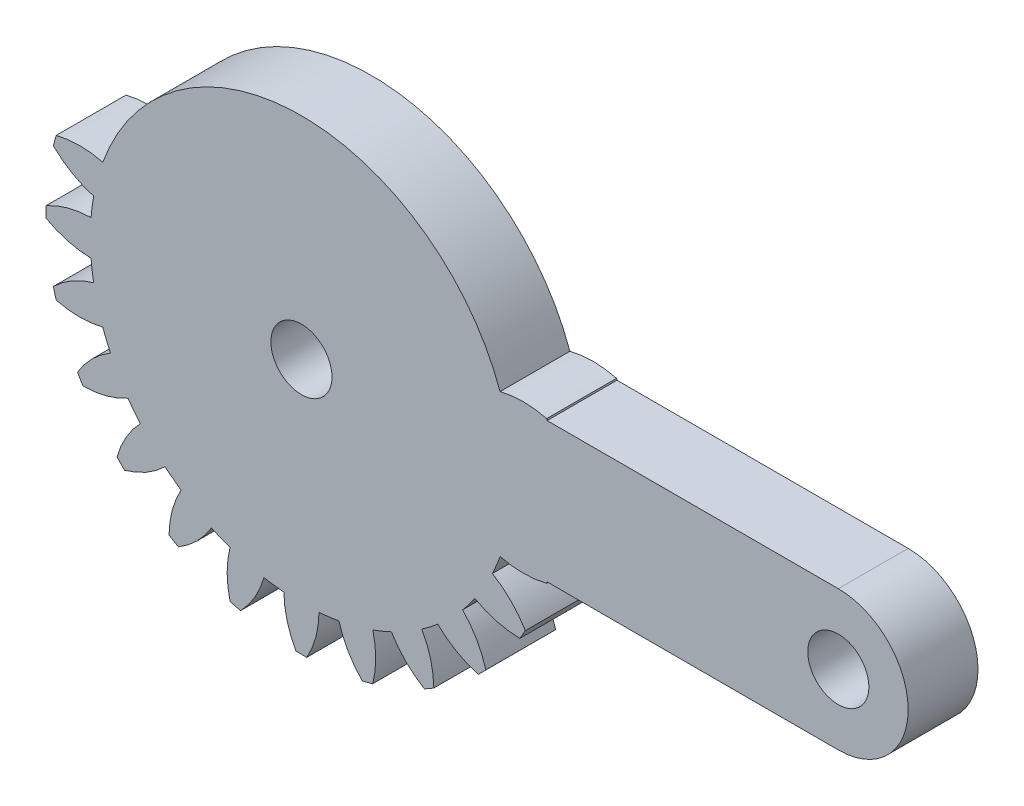
from build123d import *

# Parameters (mm, degrees)
SKETCH1_R           = 1.75
BOSS_EXTRUDE1_DEPTH = 4


with BuildPart() as part:
    # Sketch1 → Boss-Extrude1 (new body)
    with BuildSketch(Plane.XY):
        with BuildLine():
            ThreePointArc((14.048088143, -4.085109489), (14.06038767, -4.04257326), (14.072558403, -4))
            Line((14.072558403, -4), (30.75, -4))
            ThreePointArc((30.75, -4), (34.75, 0), (30.75, 4))
            Line((30.75, 4), (14.072558403, 4))
            ThreePointArc((14.072558403, 4), (14.06038767, 4.04257326), (14.048088143, 4.085109489))
            ThreePointArc((14.048088143, 4.085109489), (12.712915648, 4.255390909), (11.377106712, 4.090176385))
            ThreePointArc((11.377106712, 4.090176385), (0, 12.09), (-11.377106712, 4.090176385))
            ThreePointArc((-11.377106712, 4.090176385), (-12.712915648, 4.255390909), (-14.048088143, 4.085109489))
            ThreePointArc((-14.048088143, 4.085109489), (-14.131494839, 3.78652263), (-14.208555951, 3.486235477))
            ThreePointArc((-14.208555951, 3.486235477), (-13.137403362, 2.671181194), (-11.897951627, 2.1463567))
            ThreePointArc((-11.897951627, 2.1463567), (-11.986568374, 1.578061664), (-12.048056748, 1.00619511))
            ThreePointArc((-12.048056748, 1.00619511), (-13.381109763, 0.820047291), (-14.626715284, 0.31))
            ThreePointArc((-14.626715284, 0.31), (-14.63, 0), (-14.626715284, -0.31))
            ThreePointArc((-14.626715284, -0.31), (-13.381109763, -0.820047291), (-12.048056748, -1.00619511))
            ThreePointArc((-12.048056748, -1.00619511), (-11.986568374, -1.578061664), (-11.897951627, -2.1463567))
            ThreePointArc((-11.897951627, -2.1463567), (-13.137403362, -2.671181194), (-14.208555951, -3.486235477))
            ThreePointArc((-14.208555951, -3.486235477), (-14.131494839, -3.78652263), (-14.048088143, -4.085109489))
            ThreePointArc((-14.048088143, -4.085109489), (-12.712915648, -4.255390909), (-11.377106712, -4.090176385))
            ThreePointArc((-11.377106712, -4.090176385), (-11.169703548, -4.626642697), (-10.937020765, -5.152637848))
            ThreePointArc((-10.937020765, -5.152637848), (-11.998404632, -5.980373095), (-12.82210701, -7.044889767))
            ThreePointArc((-12.82210701, -7.044889767), (-12.669951657, -7.315), (-12.51210701, -7.581825517))
            ThreePointArc((-12.51210701, -7.581825517), (-11.17835734, -7.400736668), (-9.930825655, -6.8954189))
            ThreePointArc((-9.930825655, -6.8954189), (-9.591641884, -7.359925677), (-9.230750012, -7.807775241))
            ThreePointArc((-9.230750012, -7.807775241), (-10.041734454, -8.882012453), (-10.561852666, -10.123446462))
            ThreePointArc((-10.561852666, -10.123446462), (-10.344972209, -10.344972209), (-10.123446462, -10.561852666))
            ThreePointArc((-10.123446462, -10.561852666), (-8.882012453, -10.041734454), (-7.807775241, -9.230750012))
            ThreePointArc((-7.807775241, -9.230750012), (-7.359925677, -9.591641884), (-6.8954189, -9.930825655))
            ThreePointArc((-6.8954189, -9.930825655), (-7.400736668, -11.17835734), (-7.581825517, -12.51210701))
            ThreePointArc((-7.581825517, -12.51210701), (-7.315, -12.669951657), (-7.044889767, -12.82210701))
            ThreePointArc((-7.044889767, -12.82210701), (-5.980373095, -11.998404632), (-5.152637848, -10.937020765))
            ThreePointArc((-5.152637848, -10.937020765), (-4.626642697, -11.169703548), (-4.090176385, -11.377106712))
            ThreePointArc((-4.090176385, -11.377106712), (-4.255390909, -12.712915648), (-4.085109489, -14.048088143))
            ThreePointArc((-4.085109489, -14.048088143), (-3.78652263, -14.131494839), (-3.486235477, -14.208555951))
            ThreePointArc((-3.486235477, -14.208555951), (-2.671181194, -13.137403362), (-2.1463567, -11.897951627))
            ThreePointArc((-2.1463567, -11.897951627), (-1.578061664, -11.986568374), (-1.00619511, -12.048056748))
            ThreePointArc((-1.00619511, -12.048056748), (-0.820047291, -13.381109763), (-0.31, -14.626715284))
            ThreePointArc((-0.31, -14.626715284), (0, -14.63), (0.31, -14.626715284))
            ThreePointArc((0.31, -14.626715284), (0.820047291, -13.381109763), (1.00619511, -12.048056748))
            ThreePointArc((1.00619511, -12.048056748), (1.578061664, -11.986568374), (2.1463567, -11.897951627))
            ThreePointArc((2.1463567, -11.897951627), (2.671181194, -13.137403362), (3.486235477, -14.208555951))
            ThreePointArc((3.486235477, -14.208555951), (3.78652263, -14.131494839), (4.085109489, -14.048088143))
            ThreePointArc((4.085109489, -14.048088143), (4.255390909, -12.712915648), (4.090176385, -11.377106712))
            ThreePointArc((4.090176385, -11.377106712), (4.626642697, -11.169703548), (5.152637848, -10.937020765))
            ThreePointArc((5.152637848, -10.937020765), (5.980373095, -11.998404632), (7.044889767, -12.82210701))
            ThreePointArc((7.044889767, -12.82210701), (7.315, -12.669951657), (7.581825517, -12.51210701))
            ThreePointArc((7.581825517, -12.51210701), (7.400736668, -11.17835734), (6.8954189, -9.930825655))
            ThreePointArc((6.8954189, -9.930825655), (7.359925677, -9.591641884), (7.807775241, -9.230750012))
            ThreePointArc((7.807775241, -9.230750012), (8.882012453, -10.041734454), (10.123446462, -10.561852666))
            ThreePointArc((10.123446462, -10.561852666), (10.344972209, -10.344972209), (10.561852666, -10.123446462))
            ThreePointArc((10.561852666, -10.123446462), (10.041734454, -8.882012453), (9.230750012, -7.807775241))
            ThreePointArc((9.230750012, -7.807775241), (9.591641884, -7.359925677), (9.930825655, -6.8954189))
            ThreePointArc((9.930825655, -6.8954189), (11.17835734, -7.400736668), (12.51210701, -7.581825517))
            ThreePointArc((12.51210701, -7.581825517), (12.669951657, -7.315), (12.82210701, -7.044889767))
            ThreePointArc((12.82210701, -7.044889767), (11.998404632, -5.980373095), (10.937020765, -5.152637848))
            ThreePointArc((10.937020765, -5.152637848), (11.169703548, -4.626642697), (11.377106712, -4.090176385))
            ThreePointArc((11.377106712, -4.090176385), (12.712915648, -4.255390909), (14.048088143, -4.085109489))
        make_face()
        Circle(SKETCH1_R, mode=Mode.SUBTRACT)
        with Locations((30.75, 0)):
            Circle(SKETCH1_R, mode=Mode.SUBTRACT)
    extrude(amount=BOSS_EXTRUDE1_DEPTH)


solid = part.part
